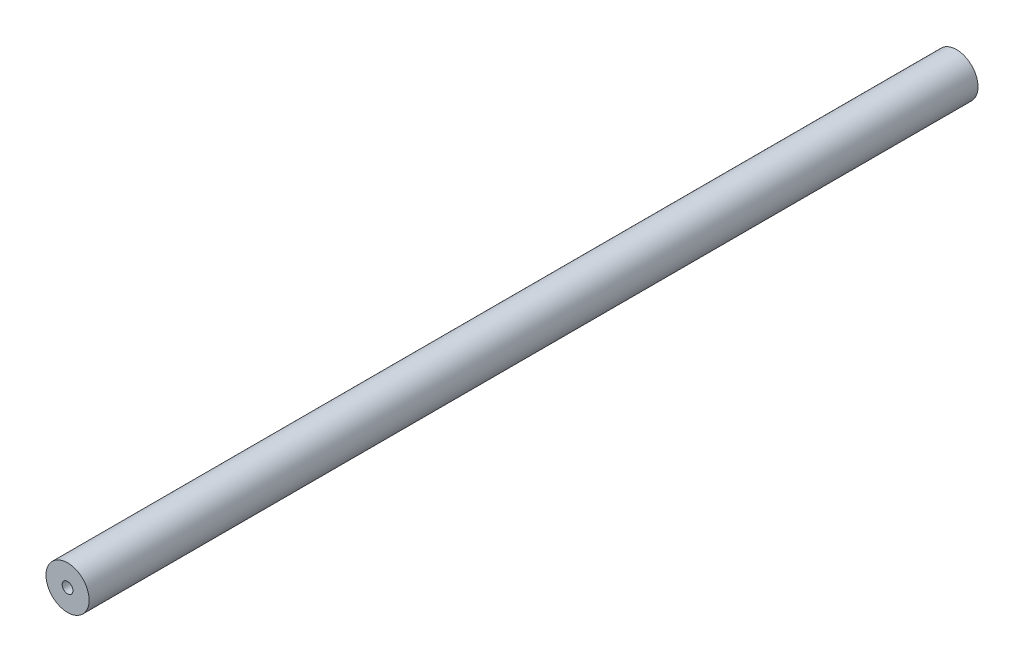
from build123d import *

# Parameters (mm, degrees)
SKETCH1_R           = 8
BOSS_EXTRUDE1_DEPTH = 330
SKETCH2_R           = 2
CUT_EXTRUDE1_DEPTH  = 331.193882439


with BuildPart() as part:
    # Sketch1 → Boss-Extrude1 (new body)
    with BuildSketch(Plane.XY):
        with Locations(Location((0, 0, 0), (0, 0, 180))):
            Circle(SKETCH1_R)
    extrude(amount=BOSS_EXTRUDE1_DEPTH)

    # Sketch2 → Cut-Extrude1 (cut, through all)
    with BuildSketch(Plane.XY.offset(330)):
        Circle(SKETCH2_R)
    extrude(amount=-CUT_EXTRUDE1_DEPTH, mode=Mode.SUBTRACT)


solid = part.part
